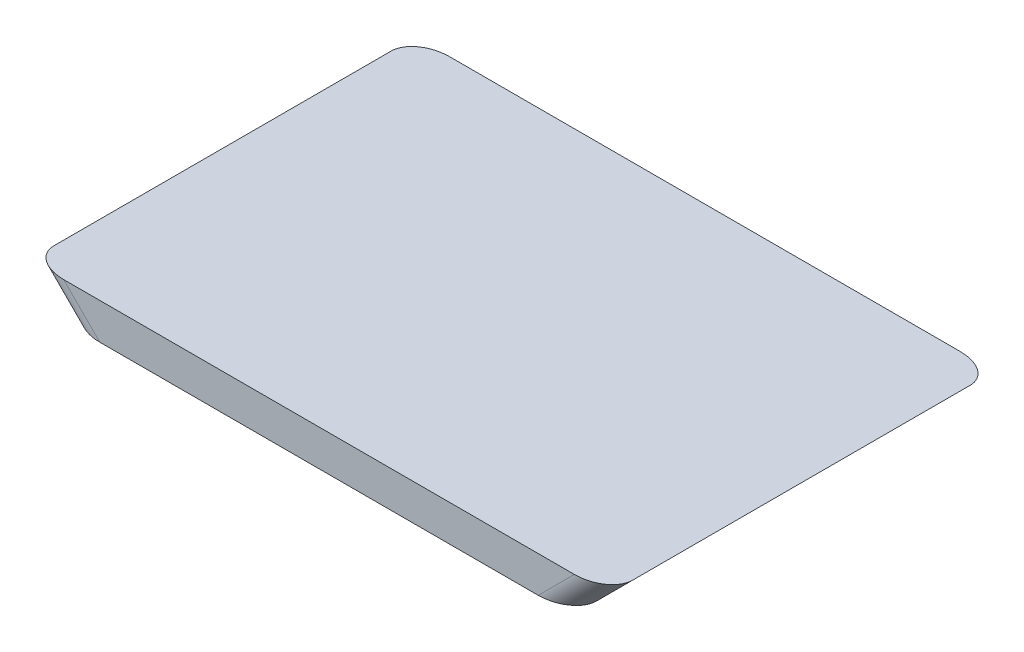
from build123d import *

# Parameters (mm, degrees)
BOSS_EXTRUDE1_DEPTH = 50.8
FILLET1_R           = 3.175


with BuildPart() as part:
    # Sketch1 → Boss-Extrude1 (new body)
    with BuildSketch(Plane.XY):
        Polygon((-38.1, 2.38125), (38.1, 2.38125), (33.3375, -2.38125), (-33.3375, -2.38125), align=None)
    extrude(amount=BOSS_EXTRUDE1_DEPTH)

    # Fillet1
    fillet1_edges = [part.edges().sort_by_distance(p)[0] for p in [
        (35.71875, 0, 50.8),
        (-35.71875, 0, 50.8),
        (35.71875, 0, 0),
        (-35.71875, 0, 0),
    ]]
    fillet(fillet1_edges, radius=FILLET1_R)


solid = part.part
